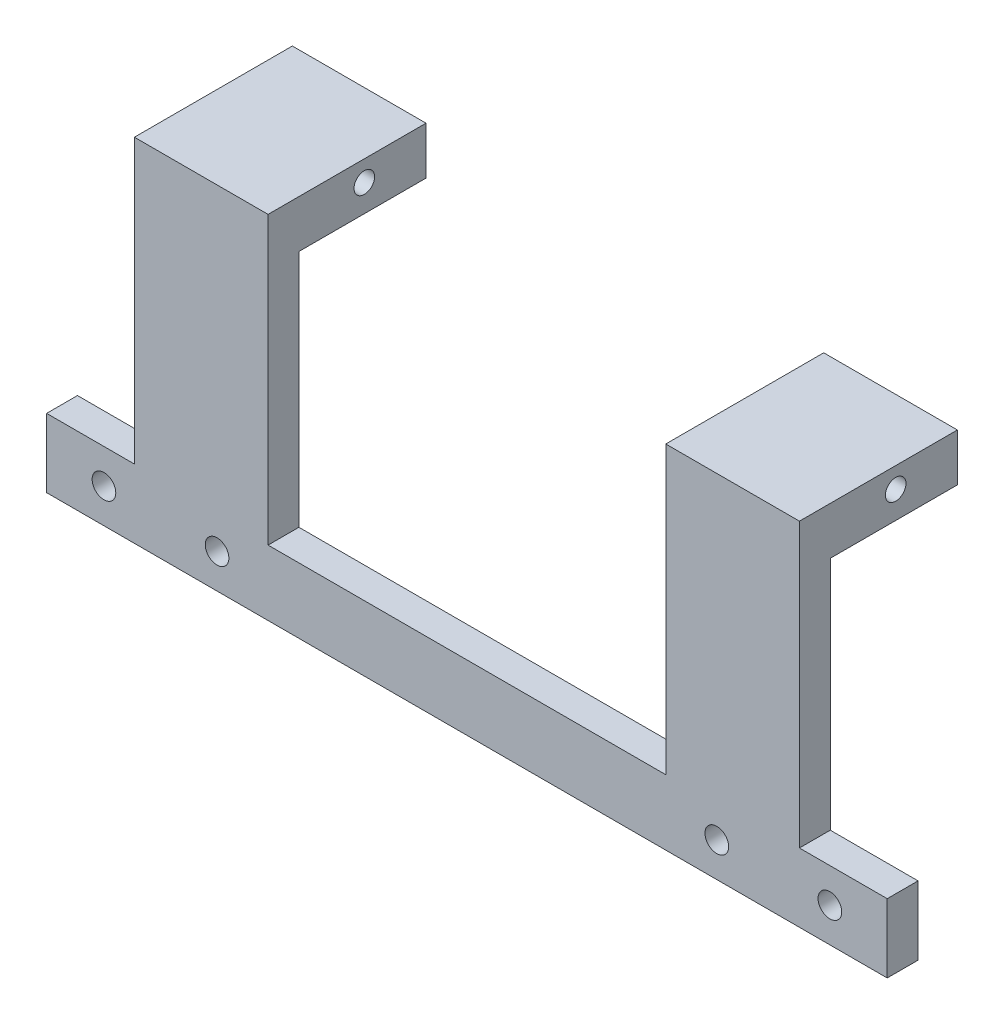
from build123d import *

# Parameters (mm, degrees)
SKETCH_1_R          = 1.149999389
SKETCH_1_R_2        = 1.149999553
SKETCH_1_R_3        = 1.149999359
SKETCH_1_R_4        = 1.149997552
EXTRUDE_1_DEPTH     = 3
SKETCH_4_W          = 12.999996185
SKETCH_4_H          = 4.628
SKETCH_4_W_2        = 13.000000328
EXTRUDE_2_DEPTH     = 12.361
SKETCH_6_R          = 1
CUT_EXTRUDE_2_DEPTH = 200


with BuildPart() as part:
    # 草图1 → 凸台-拉伸1 (new body)
    with BuildSketch(Plane.XY):
        Polygon((13.161137581, 10.828393936), (13.161137581, -17.026895523), (51.838863373, -17.026895523), (51.838863373, 10.828393936), (64.838859558, 10.828393936), (64.838859558, -16.700000763), (73.376037598, -16.700000763), (73.376037598, -23.38126564), (-8.376040459, -23.38126564), (-8.376040459, -16.700000763), (0.161137253, -16.700000763), (0.161137253, 10.828393936), align=None)
        with Locations((-2.800555034, -20.040632255)):
            Circle(SKETCH_1_R, mode=Mode.SUBTRACT)
        with Locations((8.199444431, -20.040632183)):
            Circle(SKETCH_1_R_2, mode=Mode.SUBTRACT)
        with Locations((56.800554471, -20.040632944)):
            Circle(SKETCH_1_R_3, mode=Mode.SUBTRACT)
        with Locations((67.800554915, -20.040625058)):
            Circle(SKETCH_1_R_4, mode=Mode.SUBTRACT)
    extrude(amount=EXTRUDE_1_DEPTH)

    # 草图4 → 凸台-拉伸2 (add)
    with BuildSketch(Plane(origin=(0, 0, 0), x_dir=(-1, 0, 0), z_dir=(0, 0, -1))):
        with Locations((-58.338861466, 8.514393936)):
            Rectangle(SKETCH_4_W, SKETCH_4_H)
        with Locations((-6.661137417, 8.514393936)):
            Rectangle(SKETCH_4_W_2, SKETCH_4_H)
    extrude(amount=EXTRUDE_2_DEPTH)

    # 草图6 → 切除-拉伸2 (cut)
    with BuildSketch(Plane(origin=(64.838859558, 0, 0), x_dir=(0, 0, -1), z_dir=(1, 0, 0))):
        with Locations((6.361, 8.828393936)):
            Circle(SKETCH_6_R)
    extrude(amount=-CUT_EXTRUDE_2_DEPTH, mode=Mode.SUBTRACT)


solid = part.part
